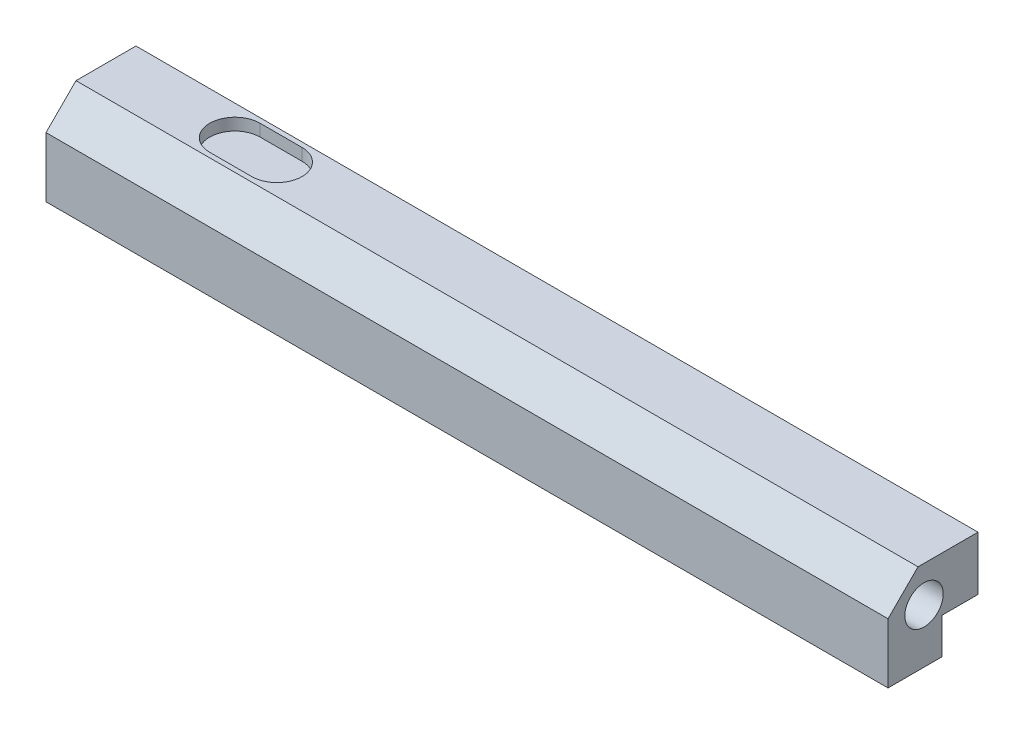
from build123d import *

# Parameters (mm, degrees)
ESQUISSE3_R             = 2.35
BOSS_EXTRU_2_DEPTH      = 70.2
CHANFREIN1_SIZE         = 5
ESQUISSE6_R             = 3.2
ESQUISSE6_R_2           = 2.35
ENL_V_MAT_EXTRU_1_DEPTH = 7
ENL_V_START             = -7
ESQUISSE7_R             = 3.2
ESQUISSE7_R_2           = 2.35
ENL_V_MAT_EXTRU_2_DEPTH = 7
ENL_V_MAT_EXTRU_3_DEPTH = 2


with BuildPart() as part:
    # Esquisse3 → Boss.-Extru.2 (new, symmetric)
    with BuildSketch(Plane(origin=(0, 0, 0), x_dir=(0, 0, -1), z_dir=(1, 0, 0))):
        Polygon((-4.5, -10.5), (-4.5, 4.5), (10.5, 4.5), (10.5, -4.5), (4.5, -4.5), (4.5, -10.5), align=None)
        with Locations((1.5, -1.5)):
            Circle(ESQUISSE3_R, mode=Mode.SUBTRACT)
    extrude(amount=BOSS_EXTRU_2_DEPTH, both=True)

    # Chanfrein1
    chanfrein1_edges = [part.edges().sort_by_distance(p)[0] for p in [
        (0, 4.5, 4.5),
    ]]
    chamfer(chanfrein1_edges, length=CHANFREIN1_SIZE)

    # Esquisse6 → Enlèv. mat.-Extru.1 (cut)
    with BuildSketch(Plane.ZY.offset(70.2)):
        with Locations((-1.5, -1.5)):
            Circle(ESQUISSE6_R)
        with Locations((-1.5, -1.5)):
            Circle(ESQUISSE6_R_2, mode=Mode.SUBTRACT)
    extrude(amount=-ENL_V_MAT_EXTRU_1_DEPTH, mode=Mode.SUBTRACT)

    # Esquisse7 → Enlèv. mat.-Extru.2 (cut)
    with BuildSketch(Plane(origin=(70.2, 0, 0), x_dir=(0, 0, -1), z_dir=(1, 0, 0)).offset(ENL_V_START)):
        with Locations(Location((1.5, -1.5, 0), (0, 0, 180))):
            Circle(ESQUISSE7_R)
        with Locations(Location((1.5, -1.5, 0), (0, 0, 180))):
            Circle(ESQUISSE7_R_2, mode=Mode.SUBTRACT)
    extrude(amount=ENL_V_MAT_EXTRU_2_DEPTH, mode=Mode.SUBTRACT)

    # Esquisse8 → Enlèv. mat.-Extru.3 (cut)
    with BuildSketch(Plane(origin=(0, 4.5, 0), x_dir=(1, 0, 0), z_dir=(0, 1, 0))):
        with BuildLine():
            Line((-48.7, 9.7), (-41.7, 9.7))
            ThreePointArc((-41.7, 9.7), (-37.5, 5.5), (-41.7, 1.3))
            Line((-41.7, 1.3), (-48.7, 1.3))
            ThreePointArc((-48.7, 1.3), (-52.9, 5.5), (-48.7, 9.7))
        make_face()
    extrude(amount=-ENL_V_MAT_EXTRU_3_DEPTH, mode=Mode.SUBTRACT)


solid = part.part
